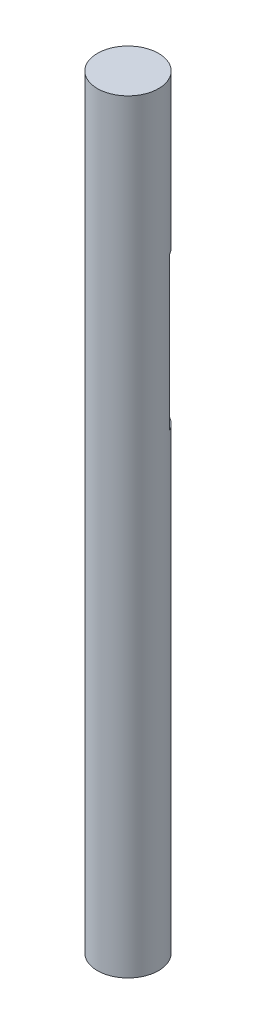
from build123d import *

# Parameters (mm, degrees)
ESQUISSE1_R             = 4
BOSS_EXTRU_1_DEPTH      = 100
ESQUISSE2_W             = 6.92820323
ESQUISSE2_H             = 8
ENL_V_MAT_EXTRU_1_DEPTH = 20


with BuildPart() as part:
    # Esquisse1 → Boss.-Extru.1 (new body)
    with BuildSketch(Plane(origin=(0, 0, 0), x_dir=(1, 0, 0), z_dir=(0, 1, 0))):
        with Locations(Location((0, 0, 0), (0, 0, 270))):
            Circle(ESQUISSE1_R)
    extrude(amount=BOSS_EXTRU_1_DEPTH)

    # Esquisse2 → Enlèv. mat.-Extru.1 (cut)
    with BuildSketch(Plane(origin=(0, 80, 0), x_dir=(1, 0, 0), z_dir=(0, 1, 0))):
        with Locations((0, 6)):
            Rectangle(ESQUISSE2_W, ESQUISSE2_H)
    extrude(amount=-ENL_V_MAT_EXTRU_1_DEPTH, mode=Mode.SUBTRACT)


solid = part.part
